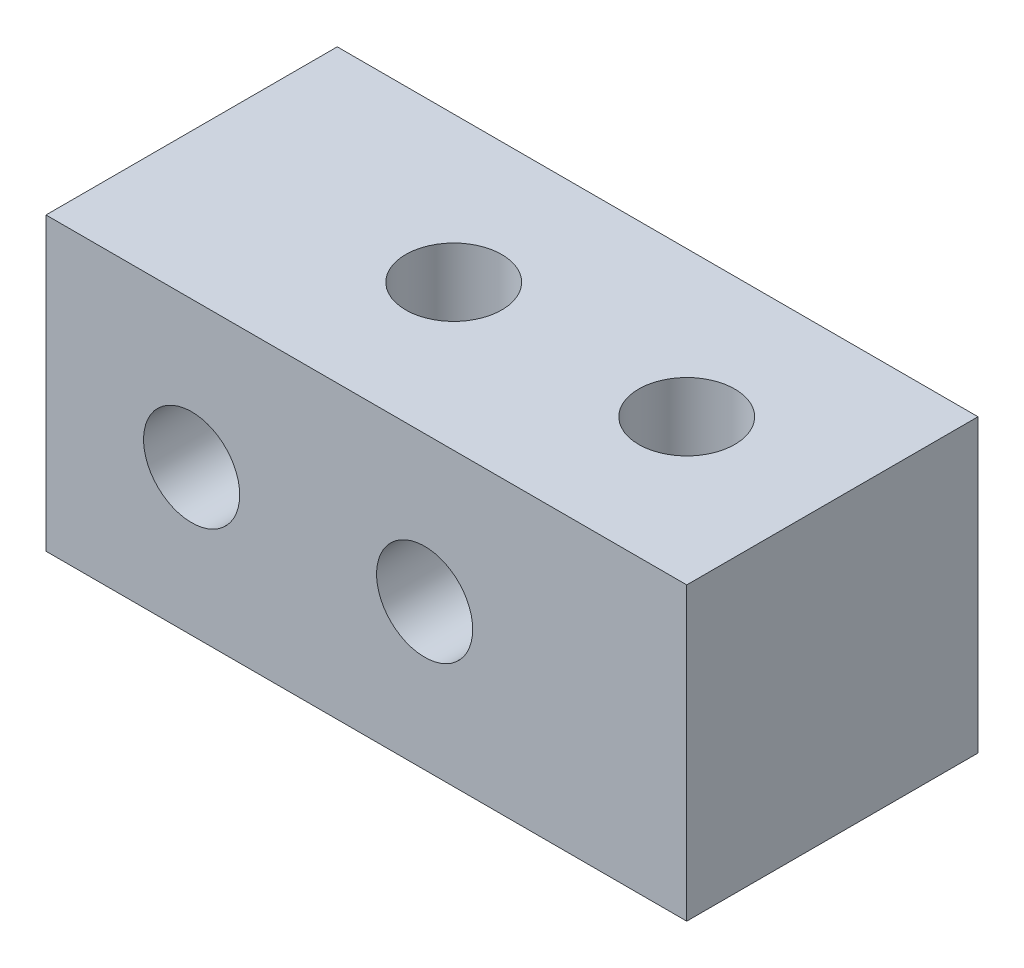
from build123d import *

# Parameters (mm, degrees)
SKETCH_1_W                   = 22
SKETCH_1_H                   = 10
EXTRUDE_1_DEPTH              = 10
HOLE_WIZARD_M4_1_D           = 3.3
HOLE_WIZARD_M4_1_ON_FACE_2_D = 3.3


with BuildPart() as part:
    # 草图1 → 凸台-拉伸1 (new body)
    with BuildSketch(Plane.XY):
        Rectangle(SKETCH_1_W, SKETCH_1_H)
    extrude(amount=EXTRUDE_1_DEPTH)

    # M4 螺纹孔的螺纹孔钻头1 (through all)
    with Locations(Plane(origin=(-6, 0, 10), x_dir=(1, 0, 0), z_dir=(0, 0, 1))):
        with Locations((0, 0), (8, 0)):
            Hole(HOLE_WIZARD_M4_1_D / 2)

    # M4 螺纹孔的螺纹孔钻头1 on face 2 (through all)
    with Locations(Plane(origin=(-2, 5, 5), x_dir=(0, 0, 1), z_dir=(0, 1, 0))):
        with Locations((0, 0), (0, 8)):
            Hole(HOLE_WIZARD_M4_1_ON_FACE_2_D / 2)


solid = part.part
